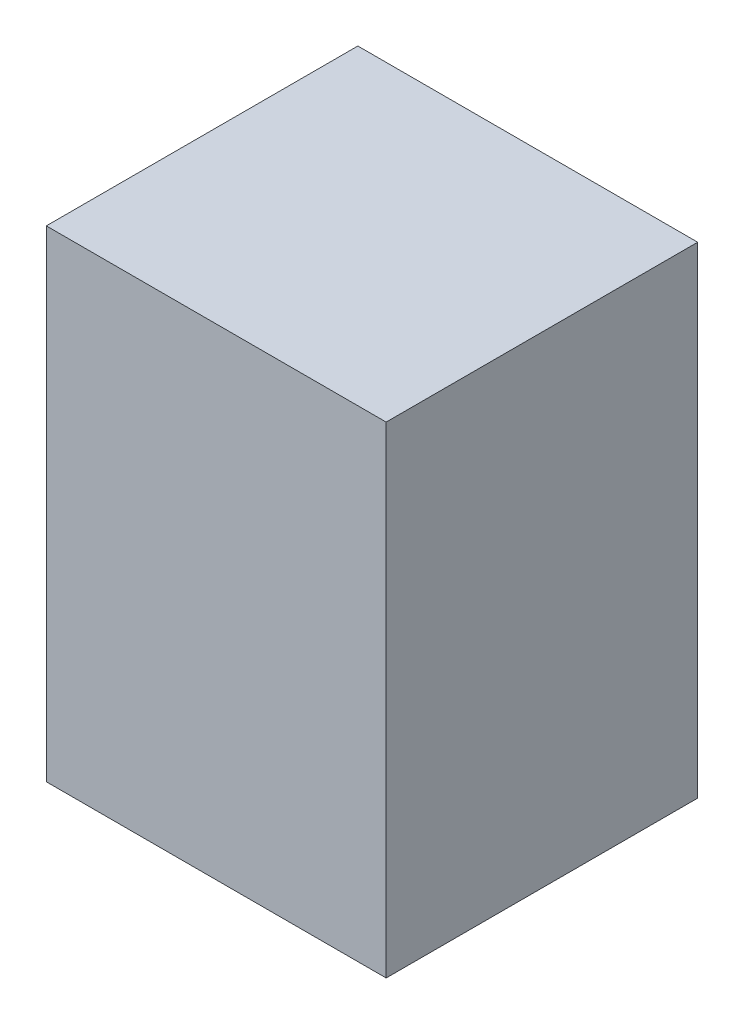
from build123d import *

# Parameters (mm, degrees)
SKETCH1_W           = 12
SKETCH1_H           = 17
BOSS_EXTRUDE1_DEPTH = 11
SKETCH2_W           = 8.2
SKETCH2_H           = 8.2
CUT_EXTRUDE1_DEPTH  = 15
SKETCH3_W           = 6
SKETCH3_H           = 3
BOSS_EXTRUDE2_DEPTH = 15
CHAMFER1_SIZE       = 1.120110988
CHAMFER1_SIZE2      = 1.260754717
CHAMFER2_SIZE       = 1.260754717
CHAMFER2_SIZE2      = 1.120110988


with BuildPart() as part:
    # Sketch1 → Boss-Extrude1 (new body)
    with BuildSketch(Plane(origin=(0, 0, -5.5), x_dir=(-1, 0, 0), z_dir=(0, 0, -1))):
        with Locations((0, 8.5)):
            Rectangle(SKETCH1_W, SKETCH1_H)
    extrude(amount=-BOSS_EXTRUDE1_DEPTH)

    # Sketch2 → Cut-Extrude1 (cut)
    with BuildSketch(Plane.XZ):
        Rectangle(SKETCH2_W, SKETCH2_H)
    extrude(amount=-CUT_EXTRUDE1_DEPTH, mode=Mode.SUBTRACT)

    # Sketch3 → Boss-Extrude2 (add)
    with BuildSketch(Plane.XZ.offset(-15)):
        Rectangle(SKETCH3_W, SKETCH3_H)
    extrude(amount=BOSS_EXTRUDE2_DEPTH)

    # Chamfer1
    chamfer1_edges = [part.edges().sort_by_distance(p)[0] for p in [
        (4.1, 7.5, 4.1),
    ]]
    chamfer1_side = [part.faces().sort_by_distance(p)[0] for p in [
        (0, 7.5, 4.1),
    ]]
    chamfer(chamfer1_edges, length=CHAMFER1_SIZE, length2=CHAMFER1_SIZE2, reference=chamfer1_side[0])

    # Chamfer2
    chamfer2_edges = [part.edges().sort_by_distance(p)[0] for p in [
        (-4.1, 7.5, 4.1),
    ]]
    chamfer2_side = [part.faces().sort_by_distance(p)[0] for p in [
        (-4.1, 7.5, 0),
    ]]
    chamfer(chamfer2_edges, length=CHAMFER2_SIZE, length2=CHAMFER2_SIZE2, reference=chamfer2_side[0])


solid = part.part
